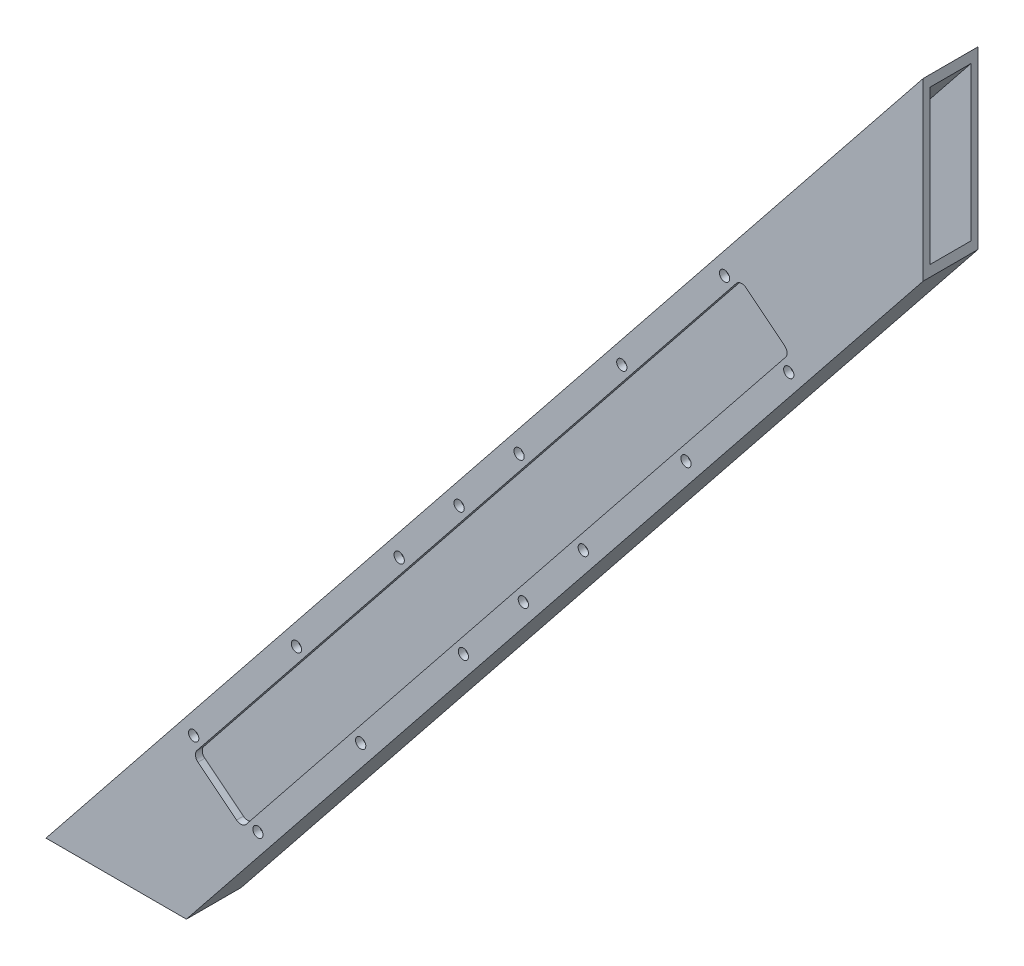
from build123d import *

# Parameters (mm, degrees)
BOSS_EXTRUDE1_DEPTH = 25.4
SHELL1_T            = -3.175
SKETCH2_R           = 2.38125
CUT_EXTRUDE1_DEPTH  = 5.08
FILLET1_R           = 3.175


with BuildPart() as part:
    # Sketch1 → Boss-Extrude1 (new body)
    with BuildSketch(Plane.XY):
        Polygon((0, 0), (406.4, 508), (406.4, 426.680322185), (65.055742252, 0), align=None)
    extrude(amount=BOSS_EXTRUDE1_DEPTH)

    # Shell1
    shell1_openings = [part.faces().sort_by_distance(p)[0] for p in [
        (406.4, 467.340161092, 12.7),
        (32.527871126, 0, 12.7),
    ]]
    offset(amount=SHELL1_T, openings=shell1_openings, kind=Kind.INTERSECTION)

    # Sketch2 → Cut-Extrude1 (cut)
    with BuildSketch(Plane.XY.offset(25.4)):
        with Locations((68.427533771, 75.369457487)):
            Circle(SKETCH2_R)
        with Locations((116.029296395, 134.871660767)):
            Circle(SKETCH2_R)
        with Locations((163.631059019, 194.373864047)):
            Circle(SKETCH2_R)
        with Locations((193.382160659, 170.572982735)):
            Circle(SKETCH2_R)
        with Locations((145.780398035, 111.070779455)):
            Circle(SKETCH2_R)
        with Locations((98.178635411, 51.568576176)):
            Circle(SKETCH2_R)
        with Locations((344.121075633, 358.996626453)):
            Circle(SKETCH2_R)
        with Locations((296.51931301, 299.494423174)):
            Circle(SKETCH2_R)
        with Locations((248.917550386, 239.992219894)):
            Circle(SKETCH2_R)
        with Locations((219.166448746, 263.793101206)):
            Circle(SKETCH2_R)
        with Locations((266.76821137, 323.295304486)):
            Circle(SKETCH2_R)
        with Locations((314.369973994, 382.797507765)):
            Circle(SKETCH2_R)
        with Locations((191.398753883, 229.083482626)):
            Circle(SKETCH2_R)
        with Locations((221.149855522, 205.282601314)):
            Circle(SKETCH2_R)
        Polygon((90.740860001, 49.386828722), (344.616927327, 366.73191288), (321.807749404, 384.979255219), (67.931682077, 67.634171061), align=None)
    extrude(amount=-CUT_EXTRUDE1_DEPTH, mode=Mode.SUBTRACT)

    # Fillet1
    fillet1_edges = [part.edges().sort_by_distance(p)[0] for p in [
        (90.740860001, 49.386828722, 23.8125),
        (67.931682077, 67.634171061, 23.8125),
        (321.807749404, 384.979255219, 23.8125),
        (344.616927327, 366.73191288, 23.8125),
    ]]
    fillet(fillet1_edges, radius=FILLET1_R)


solid = part.part
